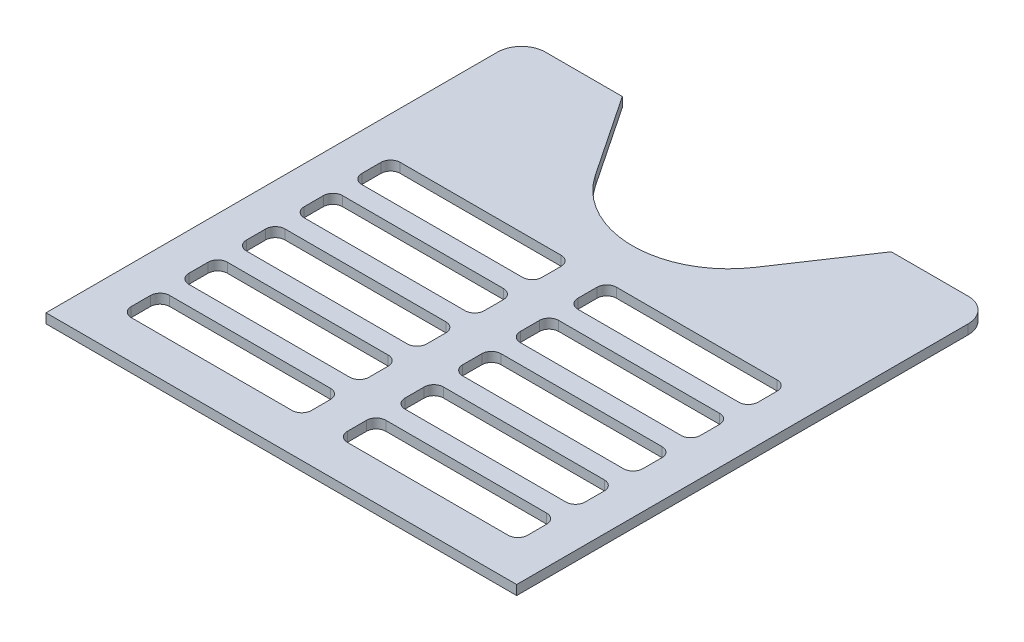
from build123d import *

# Parameters (mm, degrees)
AUFSATZ_LINEAR_AUSTRAGEN2_DEPTH = 2
SCHNITT_LINEAR_AUSTRAGEN2_DEPTH = 2


with BuildPart() as part:
    # Skizze2 → Aufsatz-Linear austragen2 (new body)
    with BuildSketch(Plane(origin=(0, 0, 0), x_dir=(1, 0, 0), z_dir=(0, 1, 0))):
        with BuildLine():
            Line((-44, 50), (-28, 50))
            Line((-28, 50), (-16.61985221, 33))
            ThreePointArc((-16.61985221, 33), (0, 24.125669082), (16.61985221, 33))
            Line((16.61985221, 33), (28, 50))
            Line((28, 50), (44, 50))
            ThreePointArc((44, 50), (47.535533906, 48.535533906), (49, 45))
            Line((49, 45), (49, -49))
            Line((49, -49), (-49, -49))
            Line((-49, -49), (-49, 45))
            ThreePointArc((-49, 45), (-47.535533906, 48.535533906), (-44, 50))
        make_face()
    extrude(amount=AUFSATZ_LINEAR_AUSTRAGEN2_DEPTH)

    # Skizze3 → Schnitt-Linear austragen2 (cut)
    with BuildSketch(Plane(origin=(0, 2, 0), x_dir=(1, 0, 0), z_dir=(0, 1, 0))):
        with BuildLine():
            Line((-39.25, 15), (-5.75, 15))
            ThreePointArc((-5.75, 15), (-4.335786438, 14.414213562), (-3.75, 13))
            Line((-3.75, 13), (-3.75, 9))
            ThreePointArc((-3.75, 9), (-4.335786438, 7.585786438), (-5.75, 7))
            Line((-5.75, 7), (-39.25, 7))
            ThreePointArc((-39.25, 7), (-40.664213562, 7.585786438), (-41.25, 9))
            Line((-41.25, 9), (-41.25, 13))
            ThreePointArc((-41.25, 13), (-40.664213562, 14.414213562), (-39.25, 15))
        make_face()
        with BuildLine():
            Line((3.75, 13), (3.75, 9))
            ThreePointArc((3.75, 9), (4.335786438, 7.585786438), (5.75, 7))
            Line((5.75, 7), (39.25, 7))
            ThreePointArc((39.25, 7), (40.664213562, 7.585786438), (41.25, 9))
            Line((41.25, 9), (41.25, 13))
            ThreePointArc((41.25, 13), (40.664213562, 14.414213562), (39.25, 15))
            Line((39.25, 15), (5.75, 15))
            ThreePointArc((5.75, 15), (4.335786438, 14.414213562), (3.75, 13))
        make_face()
        with BuildLine():
            Line((3.75, 1), (3.75, -3))
            ThreePointArc((3.75, -3), (4.335786438, -4.414213562), (5.75, -5))
            Line((5.75, -5), (39.25, -5))
            ThreePointArc((39.25, -5), (40.664213562, -4.414213562), (41.25, -3))
            Line((41.25, -3), (41.25, 1))
            ThreePointArc((41.25, 1), (40.664213562, 2.414213562), (39.25, 3))
            Line((39.25, 3), (5.75, 3))
            ThreePointArc((5.75, 3), (4.335786438, 2.414213562), (3.75, 1))
        make_face()
        with BuildLine():
            Line((3.75, -11), (3.75, -15))
            ThreePointArc((3.75, -15), (4.335786438, -16.414213562), (5.75, -17))
            Line((5.75, -17), (39.25, -17))
            ThreePointArc((39.25, -17), (40.664213562, -16.414213562), (41.25, -15))
            Line((41.25, -15), (41.25, -11))
            ThreePointArc((41.25, -11), (40.664213562, -9.585786438), (39.25, -9))
            Line((39.25, -9), (5.75, -9))
            ThreePointArc((5.75, -9), (4.335786438, -9.585786438), (3.75, -11))
        make_face()
        with BuildLine():
            Line((3.75, -23), (3.75, -27))
            ThreePointArc((3.75, -27), (4.335786438, -28.414213562), (5.75, -29))
            Line((5.75, -29), (39.25, -29))
            ThreePointArc((39.25, -29), (40.664213562, -28.414213562), (41.25, -27))
            Line((41.25, -27), (41.25, -23))
            ThreePointArc((41.25, -23), (40.664213562, -21.585786438), (39.25, -21))
            Line((39.25, -21), (5.75, -21))
            ThreePointArc((5.75, -21), (4.335786438, -21.585786438), (3.75, -23))
        make_face()
        with BuildLine():
            Line((3.75, -35), (3.75, -39))
            ThreePointArc((3.75, -39), (4.335786438, -40.414213562), (5.75, -41))
            Line((5.75, -41), (39.25, -41))
            ThreePointArc((39.25, -41), (40.664213562, -40.414213562), (41.25, -39))
            Line((41.25, -39), (41.25, -35))
            ThreePointArc((41.25, -35), (40.664213562, -33.585786438), (39.25, -33))
            Line((39.25, -33), (5.75, -33))
            ThreePointArc((5.75, -33), (4.335786438, -33.585786438), (3.75, -35))
        make_face()
        with BuildLine():
            Line((-41.25, 1), (-41.25, -3))
            ThreePointArc((-41.25, -3), (-40.664213562, -4.414213562), (-39.25, -5))
            Line((-39.25, -5), (-5.75, -5))
            ThreePointArc((-5.75, -5), (-4.335786438, -4.414213562), (-3.75, -3))
            Line((-3.75, -3), (-3.75, 1))
            ThreePointArc((-3.75, 1), (-4.335786438, 2.414213562), (-5.75, 3))
            Line((-5.75, 3), (-39.25, 3))
            ThreePointArc((-39.25, 3), (-40.664213562, 2.414213562), (-41.25, 1))
        make_face()
        with BuildLine():
            Line((-41.25, -11), (-41.25, -15))
            ThreePointArc((-41.25, -15), (-40.664213562, -16.414213562), (-39.25, -17))
            Line((-39.25, -17), (-5.75, -17))
            ThreePointArc((-5.75, -17), (-4.335786438, -16.414213562), (-3.75, -15))
            Line((-3.75, -15), (-3.75, -11))
            ThreePointArc((-3.75, -11), (-4.335786438, -9.585786438), (-5.75, -9))
            Line((-5.75, -9), (-39.25, -9))
            ThreePointArc((-39.25, -9), (-40.664213562, -9.585786438), (-41.25, -11))
        make_face()
        with BuildLine():
            Line((-41.25, -23), (-41.25, -27))
            ThreePointArc((-41.25, -27), (-40.664213562, -28.414213562), (-39.25, -29))
            Line((-39.25, -29), (-5.75, -29))
            ThreePointArc((-5.75, -29), (-4.335786438, -28.414213562), (-3.75, -27))
            Line((-3.75, -27), (-3.75, -23))
            ThreePointArc((-3.75, -23), (-4.335786438, -21.585786438), (-5.75, -21))
            Line((-5.75, -21), (-39.25, -21))
            ThreePointArc((-39.25, -21), (-40.664213562, -21.585786438), (-41.25, -23))
        make_face()
        with BuildLine():
            Line((-41.25, -35), (-41.25, -39))
            ThreePointArc((-41.25, -39), (-40.664213562, -40.414213562), (-39.25, -41))
            Line((-39.25, -41), (-5.75, -41))
            ThreePointArc((-5.75, -41), (-4.335786438, -40.414213562), (-3.75, -39))
            Line((-3.75, -39), (-3.75, -35))
            ThreePointArc((-3.75, -35), (-4.335786438, -33.585786438), (-5.75, -33))
            Line((-5.75, -33), (-39.25, -33))
            ThreePointArc((-39.25, -33), (-40.664213562, -33.585786438), (-41.25, -35))
        make_face()
    extrude(amount=-SCHNITT_LINEAR_AUSTRAGEN2_DEPTH, mode=Mode.SUBTRACT)


solid = part.part
